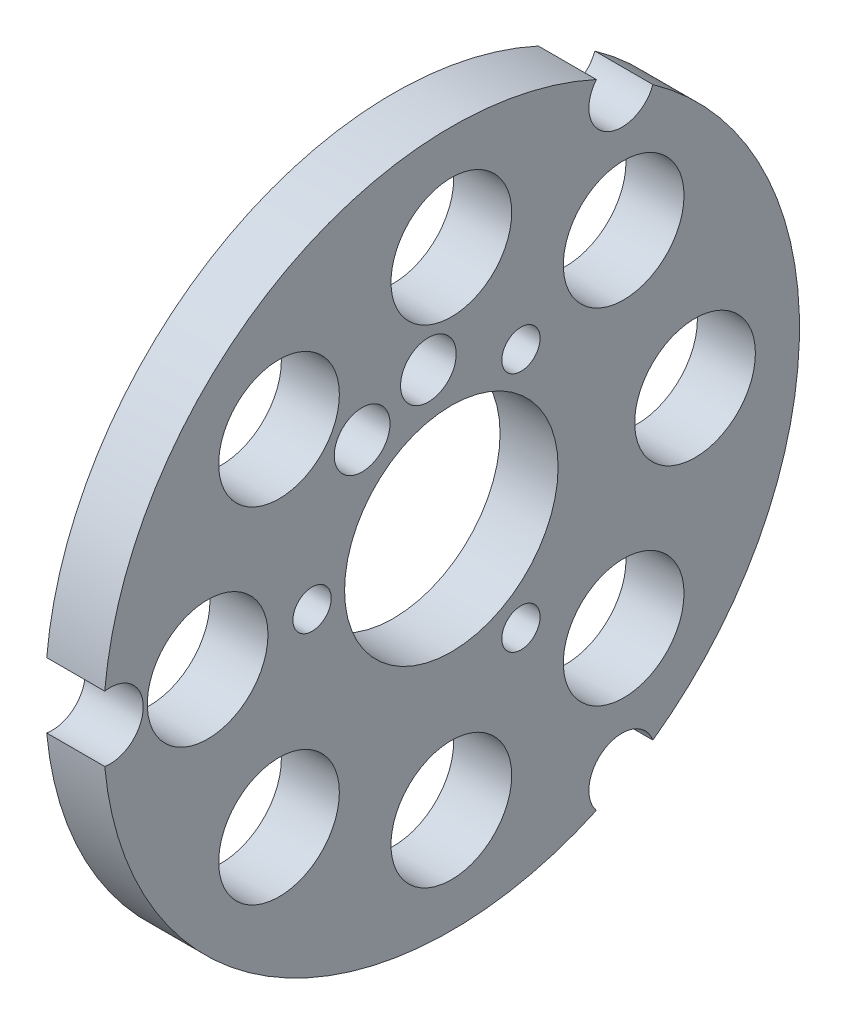
from build123d import *

# Parameters (mm, degrees)
AXIAL_PROFILE_MM_W     = 5
AXIAL_PROFILE_MM_H     = 20.8
AXIAL_HOLES_DEPTH      = 155.634051877
AXIAL_HOLES_DEPTH_BACK = 155.634051877
SKETCH2_R              = 5.2
SKETCH2_R_2            = 2.4
SKETCH2_R_3            = 1.65
SKETCH2_R_4            = 2.85


with BuildPart() as part:
    # Axial profile (mm) → Full revolution (revolve)
    with BuildSketch(Plane.XY, mode=Mode.PRIVATE) as full_revolution_sk:
        with Locations((146.2, 19.6)):
            Rectangle(AXIAL_PROFILE_MM_W, AXIAL_PROFILE_MM_H)
    revolve(full_revolution_sk.sketch.rotate(Axis((-110, 0, 0), (1, 0, 0)), 90), axis=Axis((-110, 0, 0), (1, 0, 0)))

    # Sketch2 → Axial holes (cut, two sides: drawn at the far end of the back side and taken through both)
    with BuildSketch(Plane(origin=(0, 0, 0), x_dir=(0, 0, -1), z_dir=(1, 0, 0)).offset(-AXIAL_HOLES_DEPTH_BACK)):
        with Locations((0, 21)):
            Circle(SKETCH2_R)
        with Locations((-14.849242405, 14.849242405)):
            Circle(SKETCH2_R)
        with Locations((-21, 0)):
            Circle(SKETCH2_R)
        with Locations((-14.849242405, -14.849242405)):
            Circle(SKETCH2_R)
        with Locations((0, -21)):
            Circle(SKETCH2_R)
        with Locations((14.849242405, -14.849242405)):
            Circle(SKETCH2_R)
        with Locations((21, 0)):
            Circle(SKETCH2_R)
        with Locations((14.849242405, 14.849242405)):
            Circle(SKETCH2_R)
        with Locations((-1.977382665, 12.848733704)):
            Circle(SKETCH2_R_2)
        with Locations((-7.687206041, 10.483647423)):
            Circle(SKETCH2_R_2)
        with Locations((-12, 0)):
            Circle(SKETCH2_R_3)
        with Locations((6, -10.392304845)):
            Circle(SKETCH2_R_3)
        with Locations((6, 10.392304845)):
            Circle(SKETCH2_R_3)
        with Locations((-29.4, 0)):
            Circle(SKETCH2_R_4)
        with Locations((14.7, -25.461146871)):
            Circle(SKETCH2_R_4)
        with Locations((14.7, 25.461146871)):
            Circle(SKETCH2_R_4)
    extrude(amount=AXIAL_HOLES_DEPTH + AXIAL_HOLES_DEPTH_BACK, mode=Mode.SUBTRACT)


solid = part.part
